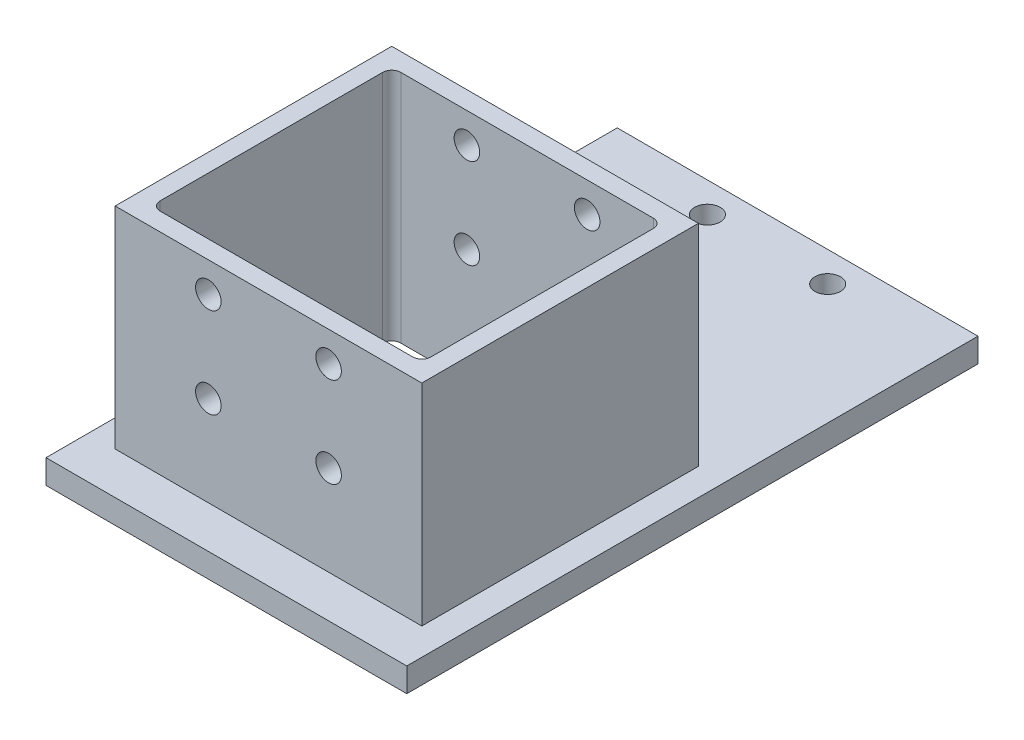
from build123d import *

# Parameters (mm, degrees)
SKETCH_1_W          = 120
SKETCH_1_H          = 190
SKETCH_1_R          = 4.25
SKETCH_1_W_2        = 90
SKETCH_1_H_2        = 80
EXTRUDE_1_DEPTH     = 8
SKETCH_2_W          = 102
SKETCH_2_H          = 92
SKETCH_2_W_2        = 90
SKETCH_2_H_2        = 80
EXTRUDE_2_DEPTH     = 70
SKETCH_3_R          = 4.25
CUT_EXTRUDE_1_DEPTH = 145.637477854
FILLET_1_R          = 3


with BuildPart() as part:
    # 草图1 → 凸台-拉伸1 (new body)
    with BuildSketch(Plane(origin=(0, 0, 0), x_dir=(1, 0, 0), z_dir=(0, 1, 0))):
        Rectangle(SKETCH_1_W, SKETCH_1_H)
        with Locations(Location((20, 85, 0), (0, 0, 270))):
            Circle(SKETCH_1_R, mode=Mode.SUBTRACT)
        with Locations(Location((20, 25, 0), (0, 0, 270))):
            Circle(SKETCH_1_R, mode=Mode.SUBTRACT)
        with Locations(Location((-20, 85, 0), (0, 0, 90))):
            Circle(SKETCH_1_R, mode=Mode.SUBTRACT)
        with Locations(Location((-20, 25, 0), (0, 0, 90))):
            Circle(SKETCH_1_R, mode=Mode.SUBTRACT)
        with Locations((0, -35)):
            Rectangle(SKETCH_1_W_2, SKETCH_1_H_2, mode=Mode.SUBTRACT)
    extrude(amount=EXTRUDE_1_DEPTH)

    # 草图2 → 凸台-拉伸2 (add)
    with BuildSketch(Plane(origin=(0, 8, 0), x_dir=(1, 0, 0), z_dir=(0, 1, 0))):
        with Locations((0, -35)):
            Rectangle(SKETCH_2_W, SKETCH_2_H)
        with Locations((0, -35)):
            Rectangle(SKETCH_2_W_2, SKETCH_2_H_2, mode=Mode.SUBTRACT)
    extrude(amount=EXTRUDE_2_DEPTH)

    # 草图3 → 切除-拉伸1 (cut, through all)
    with BuildSketch(Plane(origin=(0, 0, -11), x_dir=(-1, 0, 0), z_dir=(0, 0, -1))):
        with Locations((20, 68)):
            Circle(SKETCH_3_R)
        with Locations((20, 38)):
            Circle(SKETCH_3_R)
        with Locations(Location((-20, 38, 0), (0, 0, 180))):
            Circle(SKETCH_3_R)
        with Locations(Location((-20, 68, 0), (0, 0, 180))):
            Circle(SKETCH_3_R)
    extrude(amount=-CUT_EXTRUDE_1_DEPTH, mode=Mode.SUBTRACT)

    # 圆角1
    fillet_1_edges = [part.edges().sort_by_distance(p)[0] for p in [
        (-45, 39, -5),
        (-45, 39, 75),
        (45, 39, 75),
        (45, 39, -5),
    ]]
    fillet(fillet_1_edges, radius=FILLET_1_R)


solid = part.part
